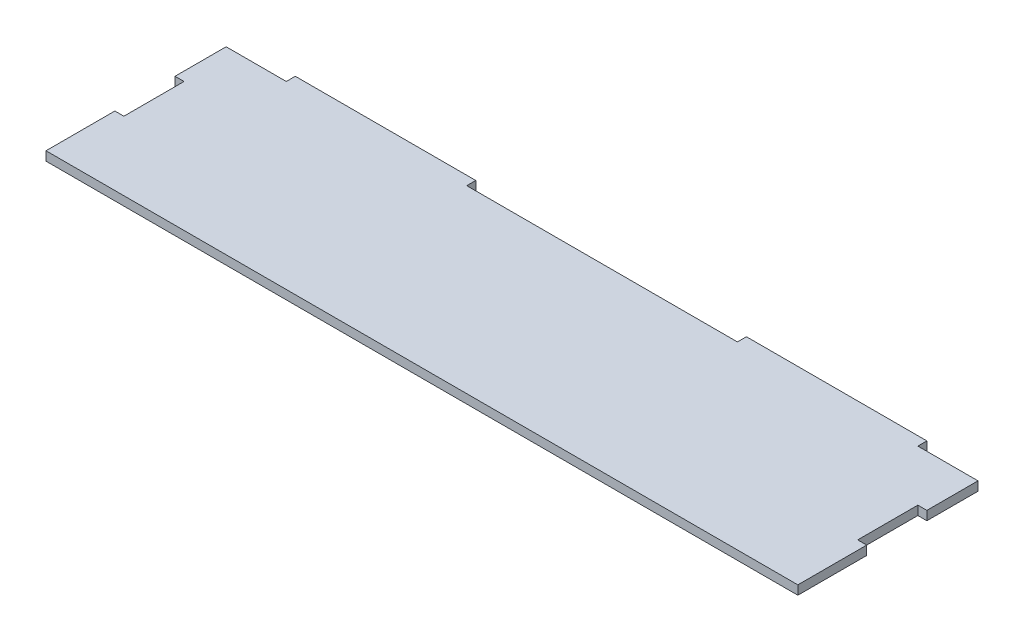
from build123d import *

# Parameters (mm, degrees)
SKETCH1_W           = 250
SKETCH1_H           = 62.9
BOSS_EXTRUDE1_DEPTH = 3
SKETCH3_W           = 3
SKETCH3_H           = 20
CUT_EXTRUDE1_DEPTH  = 258.808863308
CUT_EXTRUDE2_REACH  = 259.809
SKETCH4_W           = 20
SKETCH4_H           = 3
CUT_EXTRUDE3_REACH  = 259.809
SKETCH5_W           = 20
SKETCH5_H           = 3
CUT_EXTRUDE4_REACH  = 259.809
SKETCH6_W           = 90
SKETCH6_H           = 3


with BuildPart() as part:
    # Sketch1 → Boss-Extrude1 (new body)
    with BuildSketch(Plane(origin=(0, 0, 0), x_dir=(1, 0, 0), z_dir=(0, 1, 0))):
        with Locations((125, 31.45)):
            Rectangle(SKETCH1_W, SKETCH1_H)
    extrude(amount=BOSS_EXTRUDE1_DEPTH)

    # Sketch3 → Cut-Extrude1 (cut, through all)
    with BuildSketch(Plane(origin=(0, 3, 0), x_dir=(1, 0, 0), z_dir=(0, 1, 0))):
        with Locations((1.5, 32.9)):
            Rectangle(SKETCH3_W, SKETCH3_H)
        with Locations((248.5, 32.9)):
            Rectangle(SKETCH3_W, SKETCH3_H)
    extrude(amount=-CUT_EXTRUDE1_DEPTH, mode=Mode.SUBTRACT)

    # Sketch4 → Cut-Extrude2 (cut, up to next)
    with BuildSketch(Plane(origin=(0, 3, 0), x_dir=(1, 0, 0), z_dir=(0, 1, 0)), mode=Mode.PRIVATE) as cut_extrude2_sk1:
        with Locations((10, 61.4)):
            Rectangle(SKETCH4_W, SKETCH4_H)
    cut_extrude2_tool1 = extrude(cut_extrude2_sk1.sketch, amount=-CUT_EXTRUDE2_REACH, mode=Mode.PRIVATE) & part.part
    add(cut_extrude2_tool1.solids().sort_by_distance((10, 3, -61.4))[0], mode=Mode.SUBTRACT)

    # Sketch5 → Cut-Extrude3 (cut, up to next)
    with BuildSketch(Plane(origin=(0, 3, 0), x_dir=(1, 0, 0), z_dir=(0, 1, 0)), mode=Mode.PRIVATE) as cut_extrude3_sk1:
        with Locations((240, 61.4)):
            Rectangle(SKETCH5_W, SKETCH5_H)
    cut_extrude3_tool1 = extrude(cut_extrude3_sk1.sketch, amount=-CUT_EXTRUDE3_REACH, mode=Mode.PRIVATE) & part.part
    add(cut_extrude3_tool1.solids().sort_by_distance((240, 3, -61.4))[0], mode=Mode.SUBTRACT)

    # Sketch6 → Cut-Extrude4 (cut, up to next)
    with BuildSketch(Plane(origin=(0, 3, 0), x_dir=(1, 0, 0), z_dir=(0, 1, 0)), mode=Mode.PRIVATE) as cut_extrude4_sk1:
        with Locations((125, 61.4)):
            Rectangle(SKETCH6_W, SKETCH6_H)
    cut_extrude4_tool1 = extrude(cut_extrude4_sk1.sketch, amount=-CUT_EXTRUDE4_REACH, mode=Mode.PRIVATE) & part.part
    add(cut_extrude4_tool1.solids().sort_by_distance((125, 3, -61.4))[0], mode=Mode.SUBTRACT)


solid = part.part
